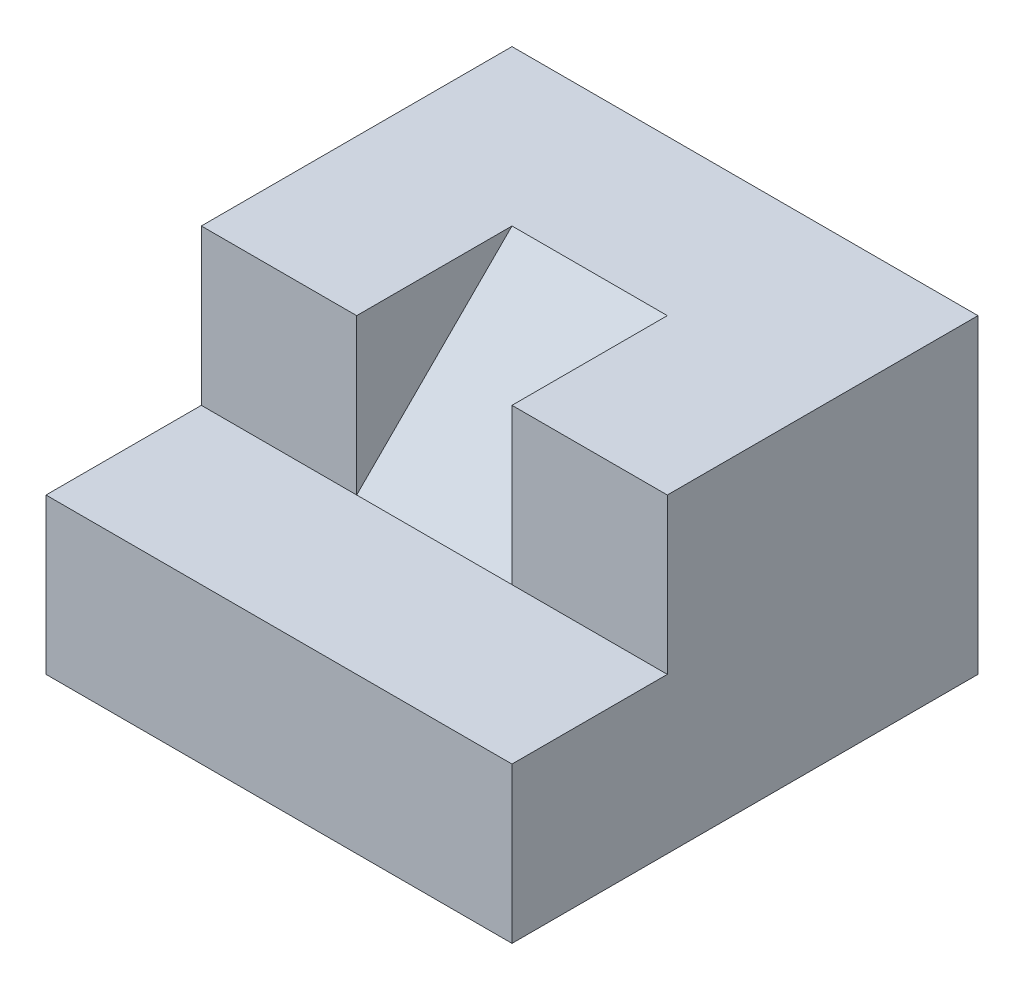
from build123d import *

# Parameters (mm, degrees)
SKETCH10_W              = 60
SKETCH10_H              = 60
BOSS_EXTRUDE6_DEPTH     = 40
SKETCH12_W              = 60
SKETCH12_H              = 20
CUT_EXTRUDE4_DEPTH      = 20
CUT_EXTRUDE7_DEPTH      = 79.102496759
CUT_EXTRUDE7_DEPTH_BACK = 79.102496759
SKETCH26_W              = 20
SKETCH26_H              = 20
BOSS_EXTRUDE8_DEPTH     = 20
SKETCH30_W              = 20
SKETCH30_H              = 20
BOSS_EXTRUDE10_DEPTH    = 20


with BuildPart() as part:
    # Sketch10 → Boss-Extrude6 (new body)
    with BuildSketch(Plane(origin=(0, 0, 0), x_dir=(1, 0, 0), z_dir=(0, 1, 0))):
        Rectangle(SKETCH10_W, SKETCH10_H)
    extrude(amount=BOSS_EXTRUDE6_DEPTH)

    # Sketch12 → Cut-Extrude4 (cut)
    with BuildSketch(Plane.XY.offset(30)):
        with Locations((0, 30)):
            Rectangle(SKETCH12_W, SKETCH12_H)
    extrude(amount=-CUT_EXTRUDE4_DEPTH, mode=Mode.SUBTRACT)

    # Sketch25 → Cut-Extrude7 (cut, two sides: drawn at the far end of the back side and taken through both)
    with BuildSketch(Plane(origin=(30, 0, 0), x_dir=(0, 0, -1), z_dir=(1, 0, 0)).offset(-CUT_EXTRUDE7_DEPTH_BACK)):
        Polygon((-10, 40), (-10, 20), (10, 40), align=None)
    extrude(amount=CUT_EXTRUDE7_DEPTH + CUT_EXTRUDE7_DEPTH_BACK, mode=Mode.SUBTRACT)

    # Sketch26 → Boss-Extrude8 (add)
    with BuildSketch(Plane(origin=(0, 20, 0), x_dir=(1, 0, 0), z_dir=(0, 1, 0))):
        with Locations((-20, 0)):
            Rectangle(SKETCH26_W, SKETCH26_H)
    extrude(amount=BOSS_EXTRUDE8_DEPTH)

    # Sketch30 → Boss-Extrude10 (add)
    with BuildSketch(Plane(origin=(0, 20, 0), x_dir=(1, 0, 0), z_dir=(0, 1, 0))):
        with Locations((20, 0)):
            Rectangle(SKETCH30_W, SKETCH30_H)
    extrude(amount=BOSS_EXTRUDE10_DEPTH)


solid = part.part
